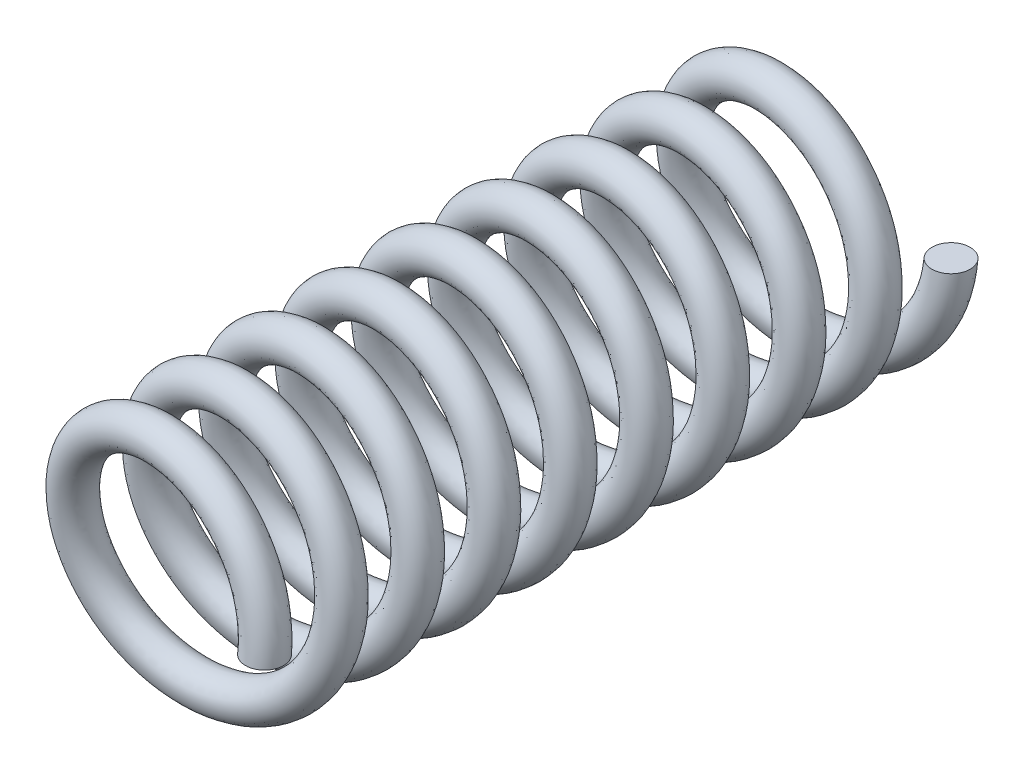
from build123d import *

# Parameters (mm, degrees)
SWEEP_1_PITCH  = 2
SWEEP_1_HEIGHT = 18
SWEEP_1_RADIUS = 3
SKETCH_5_R     = 0.5


with BuildPart() as part:
    # 扫描1: sweep along a helix
    with BuildLine() as sweep_1_path:
        Helix(SWEEP_1_PITCH, SWEEP_1_HEIGHT, SWEEP_1_RADIUS, center=(0, 0, 0), direction=(0, 0, 1), lefthand=True)
    # 草图5 → 扫描1 (sweep)
    with BuildSketch(Plane(origin=(0, 0, 0), x_dir=(1, 0, 0), z_dir=(0, 1, 0))):
        with Locations((3.005128604, 0)):
            Circle(SKETCH_5_R)
    sweep(path=sweep_1_path.line, is_frenet=True)


solid = part.part
